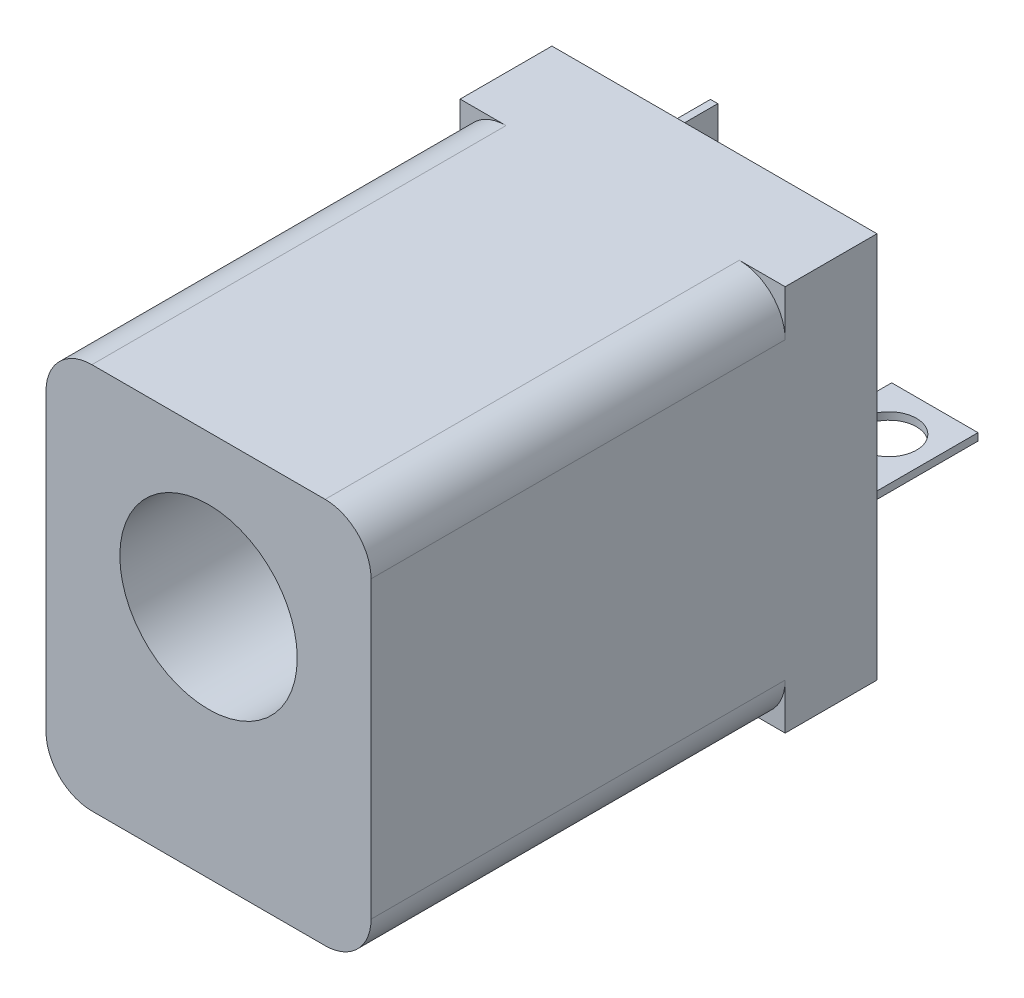
from build123d import *

# Parameters (mm, degrees)
BOSS_EXTRUDE1_DEPTH = 13.9954
SKETCH2_R           = 2.453758577
CUT_EXTRUDE1_DEPTH  = 9.2456
SKETCH3_W           = 8.9916
SKETCH3_H           = 10.6934
BOSS_EXTRUDE2_DEPTH = 2.54
SKETCH4_W           = 0.2032
SKETCH4_H           = 2.9972
SKETCH4_W_2         = 2.2098
SKETCH4_H_2         = 0.2032
SKETCH4_W_3         = 2.3876
BOSS_EXTRUDE3_DEPTH = 3.6068
CUT_EXTRUDE2_REACH  = 24.099
SKETCH5_R           = 0.762
CUT_EXTRUDE3_REACH  = 22.96
SKETCH6_R           = 0.762
CUT_EXTRUDE4_REACH  = 23.926
SKETCH7_R           = 0.635


with BuildPart() as part:
    # Sketch1 → Boss-Extrude1 (new body)
    with BuildSketch(Plane.XY):
        with BuildLine():
            Line((1.27, 0), (7.7216, 0))
            ThreePointArc((7.7216, 0), (8.619625612, 0.371974388), (8.9916, 1.27))
            Line((8.9916, 1.27), (8.9916, 9.4234))
            ThreePointArc((8.9916, 9.4234), (8.619625612, 10.321425612), (7.7216, 10.6934))
            Line((7.7216, 10.6934), (1.27, 10.6934))
            ThreePointArc((1.27, 10.6934), (0.371974388, 10.321425612), (0, 9.4234))
            Line((0, 9.4234), (0, 1.27))
            ThreePointArc((0, 1.27), (0.371974388, 0.371974388), (1.27, 0))
        make_face()
    extrude(amount=-BOSS_EXTRUDE1_DEPTH)

    # Sketch2 → Cut-Extrude1 (cut)
    with BuildSketch(Plane.XY):
        with Locations((4.4958, 6.5024)):
            Circle(SKETCH2_R)
    extrude(amount=-CUT_EXTRUDE1_DEPTH, mode=Mode.SUBTRACT)

    # Sketch3 → Boss-Extrude2 (add)
    with BuildSketch(Plane(origin=(0, 0, -13.9954), x_dir=(-1, 0, 0), z_dir=(0, 0, -1))):
        with Locations((-4.4958, 5.3467)):
            Rectangle(SKETCH3_W, SKETCH3_H)
    extrude(amount=-BOSS_EXTRUDE2_DEPTH)

    # Sketch4 → Boss-Extrude3 (add)
    with BuildSketch(Plane(origin=(0, 0, -13.9954), x_dir=(-1, 0, 0), z_dir=(0, 0, -1))):
        with Locations((-0.87884, 6.5024)):
            Rectangle(SKETCH4_W, SKETCH4_H)
        with Locations((-3.302, 1.10236)):
            Rectangle(SKETCH4_W_2, SKETCH4_H_2)
        with Locations((-6.985, 3.61696)):
            Rectangle(SKETCH4_W_3, SKETCH4_H_2)
    extrude(amount=BOSS_EXTRUDE3_DEPTH)

    # Sketch5 → Cut-Extrude2 (cut, up to next)
    with BuildSketch(Plane(origin=(0.98044, 0, 0), x_dir=(0, 0, -1), z_dir=(1, 0, 0)), mode=Mode.PRIVATE) as cut_extrude2_sk1:
        with Locations((16.0782, 6.5024)):
            Circle(SKETCH5_R)
    cut_extrude2_tool1 = extrude(cut_extrude2_sk1.sketch, amount=-CUT_EXTRUDE2_REACH, mode=Mode.PRIVATE) & part.part
    add(cut_extrude2_tool1.solids().sort_by_distance((0.98044, 6.5024, -16.0782))[0], mode=Mode.SUBTRACT)

    # Sketch6 → Cut-Extrude3 (cut, up to next)
    with BuildSketch(Plane(origin=(0, 3.71856, 0), x_dir=(1, 0, 0), z_dir=(0, 1, 0)), mode=Mode.PRIVATE) as cut_extrude3_sk1:
        with Locations(Location((6.985, 16.3322, 0), (0, 0, 180))):
            Circle(SKETCH6_R)
    cut_extrude3_tool1 = extrude(cut_extrude3_sk1.sketch, amount=-CUT_EXTRUDE3_REACH, mode=Mode.PRIVATE) & part.part
    add(cut_extrude3_tool1.solids().sort_by_distance((6.985, 3.71856, -16.3322))[0], mode=Mode.SUBTRACT)

    # Sketch7 → Cut-Extrude4 (cut, up to next)
    with BuildSketch(Plane(origin=(0, 1.20396, 0), x_dir=(1, 0, 0), z_dir=(0, 1, 0)), mode=Mode.PRIVATE) as cut_extrude4_sk1:
        with Locations(Location((3.302, 16.3322, 0), (0, 0, 180))):
            Circle(SKETCH7_R)
    cut_extrude4_tool1 = extrude(cut_extrude4_sk1.sketch, amount=-CUT_EXTRUDE4_REACH, mode=Mode.PRIVATE) & part.part
    add(cut_extrude4_tool1.solids().sort_by_distance((3.302, 1.20396, -16.3322))[0], mode=Mode.SUBTRACT)


solid = part.part
